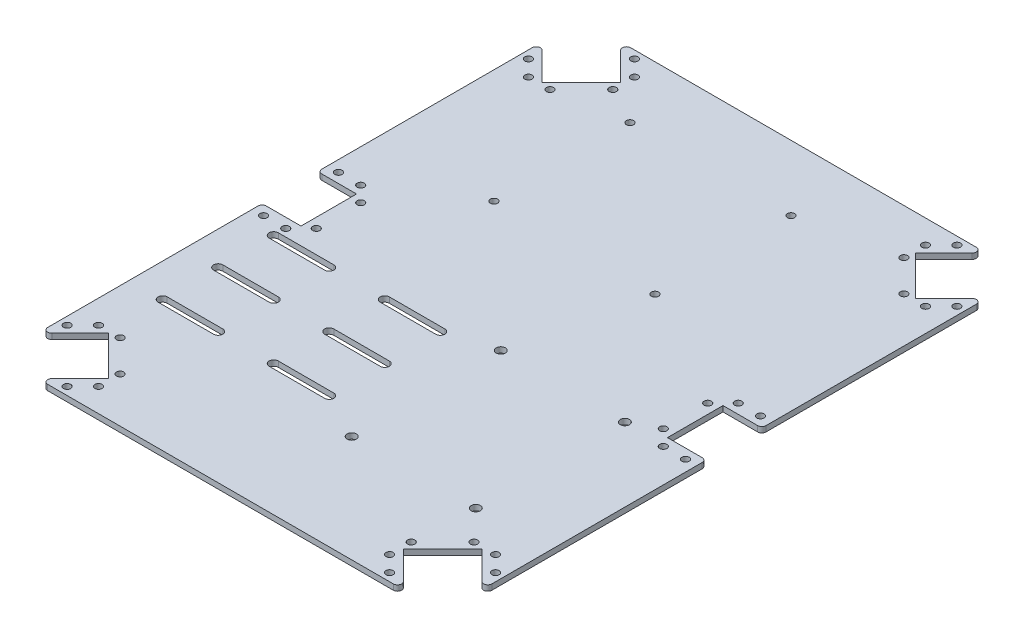
from build123d import *

# Parameters (mm, degrees)
SKETCH2_W           = 160
SKETCH2_H           = 210
SKETCH2_R           = 1.3
BOSS_EXTRUDE1_DEPTH = 2
SKETCH3_W           = 14
SKETCH3_H           = 20
CUT_EXTRUDE1_DEPTH  = 2
FILLET1_R           = 1.5
SKETCH4_R           = 1.3
CUT_EXTRUDE2_DEPTH  = 2
CUT_EXTRUDE3_DEPTH  = 2
SKETCH6_R           = 1.65
CUT_EXTRUDE4_DEPTH  = 2


with BuildPart() as part:
    # Sketch2 → Boss-Extrude1 (new body)
    with BuildSketch(Plane(origin=(0, 0, 0), x_dir=(1, 0, 0), z_dir=(0, 1, 0))):
        Rectangle(SKETCH2_W, SKETCH2_H)
        with Locations(Location((52.422835534, 88.736544033, 0), (0, 0, 270))):
            Circle(SKETCH2_R, mode=Mode.SUBTRACT)
        with Locations(Location((52.422835534, 96.514718626, 0), (0, 0, 270))):
            Circle(SKETCH2_R, mode=Mode.SUBTRACT)
        with Locations(Location((58.079689783, 102.171572875, 0), (0, 0, 270))):
            Circle(SKETCH2_R, mode=Mode.SUBTRACT)
        with Locations(Location((76, 13.5, 0), (0, 0, 270))):
            Circle(SKETCH2_R, mode=Mode.SUBTRACT)
        with Locations(Location((68, 13.5, 0), (0, 0, 270))):
            Circle(SKETCH2_R, mode=Mode.SUBTRACT)
        with Locations(Location((62.5, 8, 0), (0, 0, 270))):
            Circle(SKETCH2_R, mode=Mode.SUBTRACT)
        with Locations(Location((62.5, -8, 0), (0, 0, 90))):
            Circle(SKETCH2_R, mode=Mode.SUBTRACT)
        with Locations(Location((68, -13.5, 0), (0, 0, 90))):
            Circle(SKETCH2_R, mode=Mode.SUBTRACT)
        with Locations(Location((76, -13.5, 0), (0, 0, 90))):
            Circle(SKETCH2_R, mode=Mode.SUBTRACT)
        with Locations(Location((77.171572875, 83.079689783, 0), (0, 0, 90))):
            Circle(SKETCH2_R, mode=Mode.SUBTRACT)
        with Locations(Location((71.514718626, 77.422835534, 0), (0, 0, 90))):
            Circle(SKETCH2_R, mode=Mode.SUBTRACT)
        with Locations(Location((63.736544033, 77.422835534, 0), (0, 0, 90))):
            Circle(SKETCH2_R, mode=Mode.SUBTRACT)
        with Locations(Location((77.171572875, -83.079689783, 0), (0, 0, 270))):
            Circle(SKETCH2_R, mode=Mode.SUBTRACT)
        with Locations(Location((71.514718626, -77.422835534, 0), (0, 0, 270))):
            Circle(SKETCH2_R, mode=Mode.SUBTRACT)
        with Locations(Location((63.736544033, -77.422835534, 0), (0, 0, 270))):
            Circle(SKETCH2_R, mode=Mode.SUBTRACT)
        with Locations(Location((58.079689783, -102.171572875, 0), (0, 0, 90))):
            Circle(SKETCH2_R, mode=Mode.SUBTRACT)
        with Locations(Location((52.422835534, -96.514718626, 0), (0, 0, 90))):
            Circle(SKETCH2_R, mode=Mode.SUBTRACT)
        with Locations(Location((52.422835534, -88.736544033, 0), (0, 0, 90))):
            Circle(SKETCH2_R, mode=Mode.SUBTRACT)
        with Locations(Location((-58.079689783, 102.171572875, 0), (0, 0, 90))):
            Circle(SKETCH2_R, mode=Mode.SUBTRACT)
        with Locations(Location((-52.422835534, 96.514718626, 0), (0, 0, 90))):
            Circle(SKETCH2_R, mode=Mode.SUBTRACT)
        with Locations(Location((-52.422835534, 88.736544033, 0), (0, 0, 90))):
            Circle(SKETCH2_R, mode=Mode.SUBTRACT)
        with Locations(Location((-77.171572875, 83.079689783, 0), (0, 0, 270))):
            Circle(SKETCH2_R, mode=Mode.SUBTRACT)
        with Locations(Location((-71.514718626, 77.422835534, 0), (0, 0, 270))):
            Circle(SKETCH2_R, mode=Mode.SUBTRACT)
        with Locations(Location((-63.736544033, 77.422835534, 0), (0, 0, 270))):
            Circle(SKETCH2_R, mode=Mode.SUBTRACT)
        with Locations(Location((-77.171572875, -83.079689783, 0), (0, 0, 90))):
            Circle(SKETCH2_R, mode=Mode.SUBTRACT)
        with Locations(Location((-71.514718626, -77.422835534, 0), (0, 0, 90))):
            Circle(SKETCH2_R, mode=Mode.SUBTRACT)
        with Locations(Location((-63.736544033, -77.422835534, 0), (0, 0, 90))):
            Circle(SKETCH2_R, mode=Mode.SUBTRACT)
        with Locations(Location((-52.422835534, -88.736544033, 0), (0, 0, 270))):
            Circle(SKETCH2_R, mode=Mode.SUBTRACT)
        with Locations(Location((-52.422835534, -96.514718626, 0), (0, 0, 270))):
            Circle(SKETCH2_R, mode=Mode.SUBTRACT)
        with Locations(Location((-58.079689783, -102.171572875, 0), (0, 0, 270))):
            Circle(SKETCH2_R, mode=Mode.SUBTRACT)
        with Locations(Location((-62.5, -8, 0), (0, 0, 270))):
            Circle(SKETCH2_R, mode=Mode.SUBTRACT)
        with Locations(Location((-68, -13.5, 0), (0, 0, 270))):
            Circle(SKETCH2_R, mode=Mode.SUBTRACT)
        with Locations(Location((-76, -13.5, 0), (0, 0, 270))):
            Circle(SKETCH2_R, mode=Mode.SUBTRACT)
        with Locations(Location((-76, 13.5, 0), (0, 0, 90))):
            Circle(SKETCH2_R, mode=Mode.SUBTRACT)
        with Locations(Location((-68, 13.5, 0), (0, 0, 90))):
            Circle(SKETCH2_R, mode=Mode.SUBTRACT)
        with Locations(Location((-62.5, 8, 0), (0, 0, 90))):
            Circle(SKETCH2_R, mode=Mode.SUBTRACT)
    extrude(amount=BOSS_EXTRUDE1_DEPTH)

    # Sketch3 → Cut-Extrude1 (cut)
    with BuildSketch(Plane(origin=(0, 2, 0), x_dir=(1, 0, 0), z_dir=(0, 1, 0))):
        with Locations((73, 0)):
            Rectangle(SKETCH3_W, SKETCH3_H)
        Polygon((65.857864376, 105), (53.129942315, 92.272077939), (67.272077939, 78.129942315), (80, 90.857864376), (80, 105), align=None)
        Polygon((80, -90.857864376), (80, -105), (65.857864376, -105), (53.129942315, -92.272077939), (67.272077939, -78.129942315), align=None)
        Polygon((-80, 90.857864376), (-80, 105), (-65.857864376, 105), (-53.129942315, 92.272077939), (-67.272077939, 78.129942315), align=None)
        with Locations((-73, 0)):
            Rectangle(SKETCH3_W, SKETCH3_H)
        Polygon((-67.272077939, -78.129942315), (-80, -90.857864376), (-80, -105), (-65.857864376, -105), (-53.129942315, -92.272077939), align=None)
    extrude(amount=-CUT_EXTRUDE1_DEPTH, mode=Mode.SUBTRACT)

    # Fillet1
    fillet1_edges = [part.edges().sort_by_distance(p)[0] for p in [
        (65.857864376, 1, -105),
        (80, 1, -90.857864376),
        (80, 1, 90.857864376),
        (65.857864376, 1, 105),
        (-80, 1, -90.857864376),
        (-65.857864376, 1, -105),
        (-80, 1, 10),
        (-80, 1, -10),
        (-65.857864376, 1, 105),
        (-80, 1, 90.857864376),
        (80, 1, -10),
        (80, 1, 10),
    ]]
    fillet(fillet1_edges, radius=FILLET1_R)

    # Sketch4 → Cut-Extrude2 (cut)
    with BuildSketch(Plane(origin=(0, 2, 0), x_dir=(1, 0, 0), z_dir=(0, 1, 0))):
        with Locations(Location((-39, 81.5, 0), (0, 0, 270))):
            Circle(SKETCH4_R)
        with Locations(Location((19, 81.5, 0), (0, 0, 270))):
            Circle(SKETCH4_R)
        with Locations(Location((19, 32.5, 0), (0, 0, 270))):
            Circle(SKETCH4_R)
        with Locations(Location((-39, 32.5, 0), (0, 0, 270))):
            Circle(SKETCH4_R)
    extrude(amount=-CUT_EXTRUDE2_DEPTH, mode=Mode.SUBTRACT)

    # Sketch5 → Cut-Extrude3 (cut)
    with BuildSketch(Plane(origin=(0, 2, 0), x_dir=(1, 0, 0), z_dir=(0, 1, 0))):
        with BuildLine():
            Line((-48, -56.188660248), (-68, -56.188660248))
            ThreePointArc((-68, -56.188660248), (-69.64999998, -57.838916868), (-67.999486759, -59.488660168))
            Line((-67.999486759, -59.488660168), (-47.856342163, -59.482394541))
            ThreePointArc((-47.856342163, -59.482394541), (-46.351567171, -57.766763041), (-48, -56.188660248))
        make_face()
        with BuildLine():
            Line((-48, -36.188660248), (-68, -36.188660248))
            ThreePointArc((-68, -36.188660248), (-69.64999998, -37.838916868), (-67.999486759, -39.488660168))
            Line((-67.999486759, -39.488660168), (-47.856342163, -39.482394541))
            ThreePointArc((-47.856342163, -39.482394541), (-46.351567171, -37.766763041), (-48, -36.188660248))
        make_face()
        with BuildLine():
            Line((-48, -16.188660248), (-68, -16.188660248))
            ThreePointArc((-68, -16.188660248), (-69.64999998, -17.838916868), (-67.999486759, -19.488660168))
            Line((-67.999486759, -19.488660168), (-47.856342163, -19.482394541))
            ThreePointArc((-47.856342163, -19.482394541), (-46.351567171, -17.766763041), (-48, -16.188660248))
        make_face()
        with BuildLine():
            Line((-28.143657837, -19.482394541), (-8.000513241, -19.488660168))
            ThreePointArc((-8.000513241, -19.488660168), (-6.35000002, -17.838916868), (-8, -16.188660248))
            Line((-8, -16.188660248), (-28, -16.188660248))
            ThreePointArc((-28, -16.188660248), (-29.648432829, -17.766763041), (-28.143657837, -19.482394541))
        make_face()
        with BuildLine():
            Line((-28.143657837, -39.482394541), (-8.000513241, -39.488660168))
            ThreePointArc((-8.000513241, -39.488660168), (-6.35000002, -37.838916868), (-8, -36.188660248))
            Line((-8, -36.188660248), (-28, -36.188660248))
            ThreePointArc((-28, -36.188660248), (-29.648432829, -37.766763041), (-28.143657837, -39.482394541))
        make_face()
        with BuildLine():
            Line((-28.143657837, -59.482394541), (-8.000513241, -59.488660168))
            ThreePointArc((-8.000513241, -59.488660168), (-6.35000002, -57.838916868), (-8, -56.188660248))
            Line((-8, -56.188660248), (-28, -56.188660248))
            ThreePointArc((-28, -56.188660248), (-29.648432829, -57.766763041), (-28.143657837, -59.482394541))
        make_face()
    extrude(amount=-CUT_EXTRUDE3_DEPTH, mode=Mode.SUBTRACT)

    # Sketch6 → Cut-Extrude4 (cut)
    with BuildSketch(Plane(origin=(0, 2, 0), x_dir=(1, 0, 0), z_dir=(0, 1, 0))):
        with Locations(Location((8.790094163, -66.528420774, 0), (0, 0, 270))):
            Circle(SKETCH6_R)
        with Locations(Location((8.790094163, -12.828420774, 0), (0, 0, 270))):
            Circle(SKETCH6_R)
        with Locations(Location((53.490094163, -12.828420774, 0), (0, 0, 270))):
            Circle(SKETCH6_R)
        with Locations(Location((53.490094163, -66.528420774, 0), (0, 0, 270))):
            Circle(SKETCH6_R)
    extrude(amount=-CUT_EXTRUDE4_DEPTH, mode=Mode.SUBTRACT)


solid = part.part
